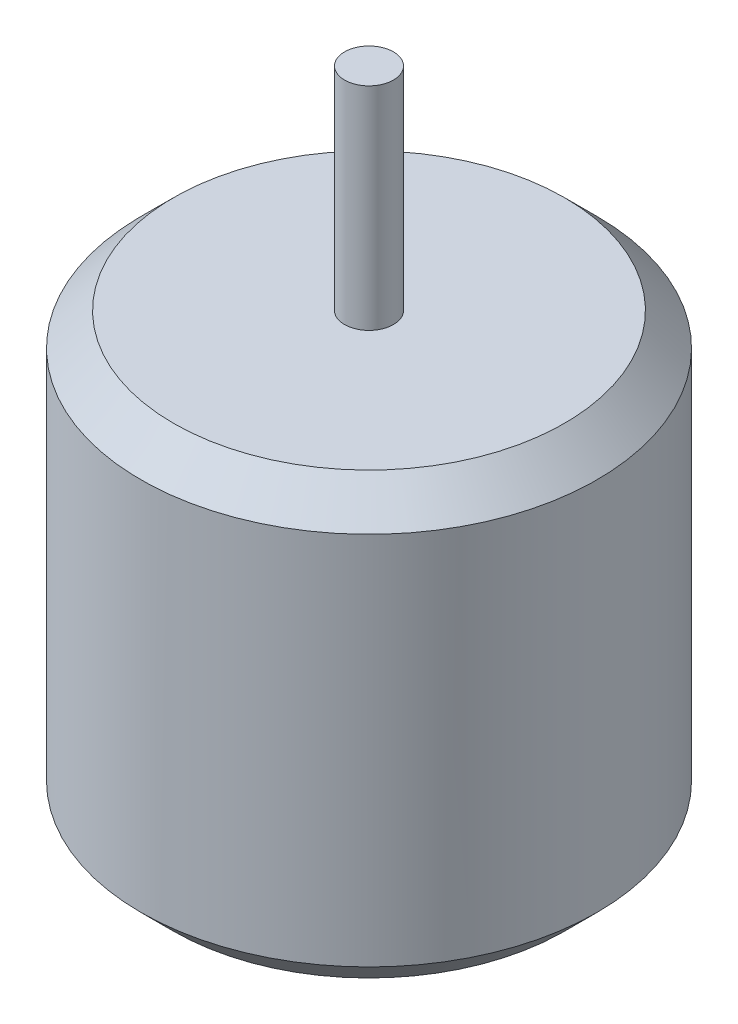
from build123d import *

# Parameters (mm, degrees)
SKETCH1_R           = 14
SKETCH1_R_2         = 1.6
SKETCH1_R_3         = 4.25
BOSS_EXTRUDE1_DEPTH = 26
CHAMFER1_SIZE       = 2
SKETCH2_R           = 14
BOSS_EXTRUDE2_DEPTH = 1
CHAMFER2_SIZE       = 2
SKETCH4_R           = 1.5
BOSS_EXTRUDE3_DEPTH = 13


with BuildPart() as part:
    # Sketch1 → Boss-Extrude1 (new body)
    with BuildSketch(Plane(origin=(0, 0, 0), x_dir=(1, 0, 0), z_dir=(0, 1, 0))):
        with Locations(Location((0, 0, 0), (0, 0, 90))):
            Circle(SKETCH1_R)
        with Locations(Location((-6.717514421, 6.717514421, 0), (0, 0, 90))):
            Circle(SKETCH1_R_2, mode=Mode.SUBTRACT)
        with Locations(Location((5.656854249, 5.656854249, 0), (0, 0, 90))):
            Circle(SKETCH1_R_2, mode=Mode.SUBTRACT)
        with Locations(Location((0, 0, 0), (0, 0, 90))):
            Circle(SKETCH1_R_3, mode=Mode.SUBTRACT)
        with Locations(Location((6.717514421, -6.717514421, 0), (0, 0, 90))):
            Circle(SKETCH1_R_2, mode=Mode.SUBTRACT)
        with Locations(Location((-5.656854249, -5.656854249, 0), (0, 0, 90))):
            Circle(SKETCH1_R_2, mode=Mode.SUBTRACT)
    extrude(amount=BOSS_EXTRUDE1_DEPTH)

    # Chamfer1
    chamfer1_edges = [part.edges().sort_by_distance(p)[0] for p in [
        (0, 0, 14),
    ]]
    chamfer(chamfer1_edges, length=CHAMFER1_SIZE)

    # Sketch2 → Boss-Extrude2 (add)
    with BuildSketch(Plane(origin=(0, 26, 0), x_dir=(1, 0, 0), z_dir=(0, 1, 0))):
        with Locations(Location((0, 0, 0), (0, 0, 90))):
            Circle(SKETCH2_R)
    extrude(amount=BOSS_EXTRUDE2_DEPTH)

    # Chamfer2
    chamfer2_edges = [part.edges().sort_by_distance(p)[0] for p in [
        (0, 27, 14),
    ]]
    chamfer(chamfer2_edges, length=CHAMFER2_SIZE)

    # Sketch4 → Boss-Extrude3 (add)
    with BuildSketch(Plane(origin=(0, 27, 0), x_dir=(1, 0, 0), z_dir=(0, 1, 0))):
        with Locations(Location((0, 0, 0), (0, 0, 90))):
            Circle(SKETCH4_R)
    extrude(amount=BOSS_EXTRUDE3_DEPTH)


solid = part.part
